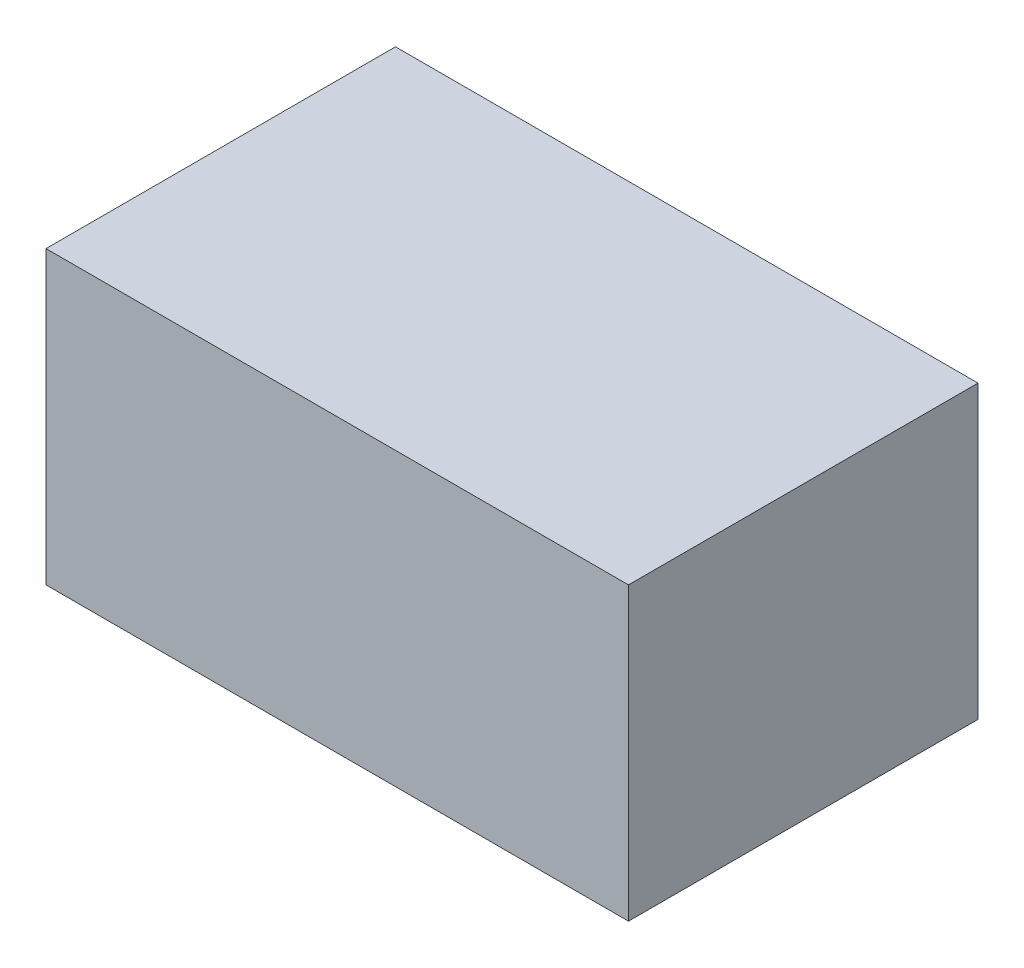
from build123d import *

# Parameters (mm, degrees)
BOSS_EXTRUDE1_DEPTH      = 50
BOSS_EXTRUDE1_DEPTH_BACK = 50
SKETCH1_W                = 200
SKETCH1_H                = 120


with BuildPart() as part:
    # Sketch1 → Boss-Extrude1 (new, two sides: drawn at the far end of the back side and taken through both)
    with BuildSketch(Plane(origin=(0, 0, 0), x_dir=(1, 0, 0), z_dir=(0, 1, 0)).offset(-BOSS_EXTRUDE1_DEPTH_BACK)):
        Rectangle(SKETCH1_W, SKETCH1_H)
    extrude(amount=BOSS_EXTRUDE1_DEPTH + BOSS_EXTRUDE1_DEPTH_BACK)


solid = part.part
